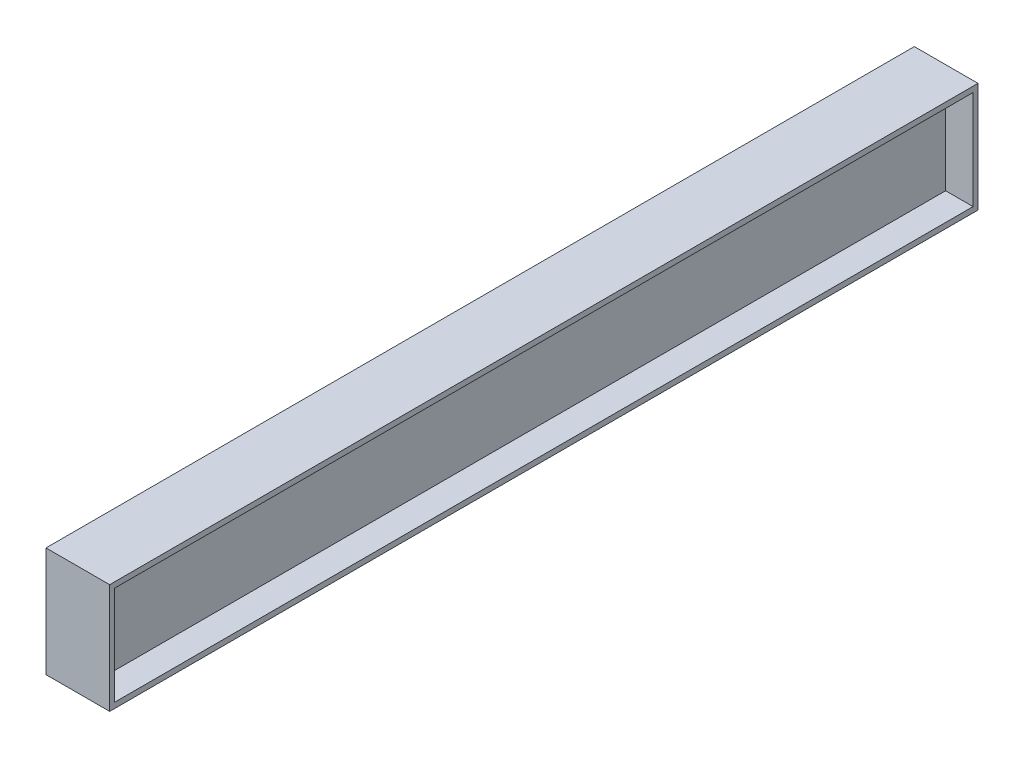
from build123d import *

# Parameters (mm, degrees)
BOSS_EXTRUDE1_DEPTH = 2636.78
SKETCH2_W           = 193.333333334
SKETCH2_H           = 300
BOSS_EXTRUDE2_DEPTH = 15
SKETCH3_W           = 193.333
SKETCH3_H           = 300
BOSS_EXTRUDE4_DEPTH = 15


with BuildPart() as part:
    # Sketch1 → Boss-Extrude1 (new body)
    with BuildSketch(Plane.XY):
        Polygon((-13.333333333, -4.45387532), (-13.333333333, 145.54612468), (-96.666333333, 145.54612468), (-96.666333333, 162.212791347), (-13.333333333, 162.212791347), (0, 162.212791347), (96.666666667, 162.212791347), (96.666666667, 145.54612468), (13.333333333, 145.54612468), (13.333333333, -154.45387532), (96.666666667, -154.45387532), (96.666666667, -171.120541986), (-96.666666667, -171.120541986), (-96.666666667, -154.45387532), (-13.333333333, -154.45387532), align=None)
    extrude(amount=BOSS_EXTRUDE1_DEPTH)

    # Sketch2 → Boss-Extrude2 (add)
    with BuildSketch(Plane(origin=(0, 0, 0), x_dir=(-1, 0, 0), z_dir=(0, 0, -1))):
        with Locations((0, -4.45387532)):
            Rectangle(SKETCH2_W, SKETCH2_H)
    extrude(amount=-BOSS_EXTRUDE2_DEPTH)

    # Sketch3 → Boss-Extrude4 (add)
    with BuildSketch(Plane.XY.offset(2636.78)):
        with Locations((0.000166667, -4.45387532)):
            Rectangle(SKETCH3_W, SKETCH3_H)
    extrude(amount=-BOSS_EXTRUDE4_DEPTH)


solid = part.part
